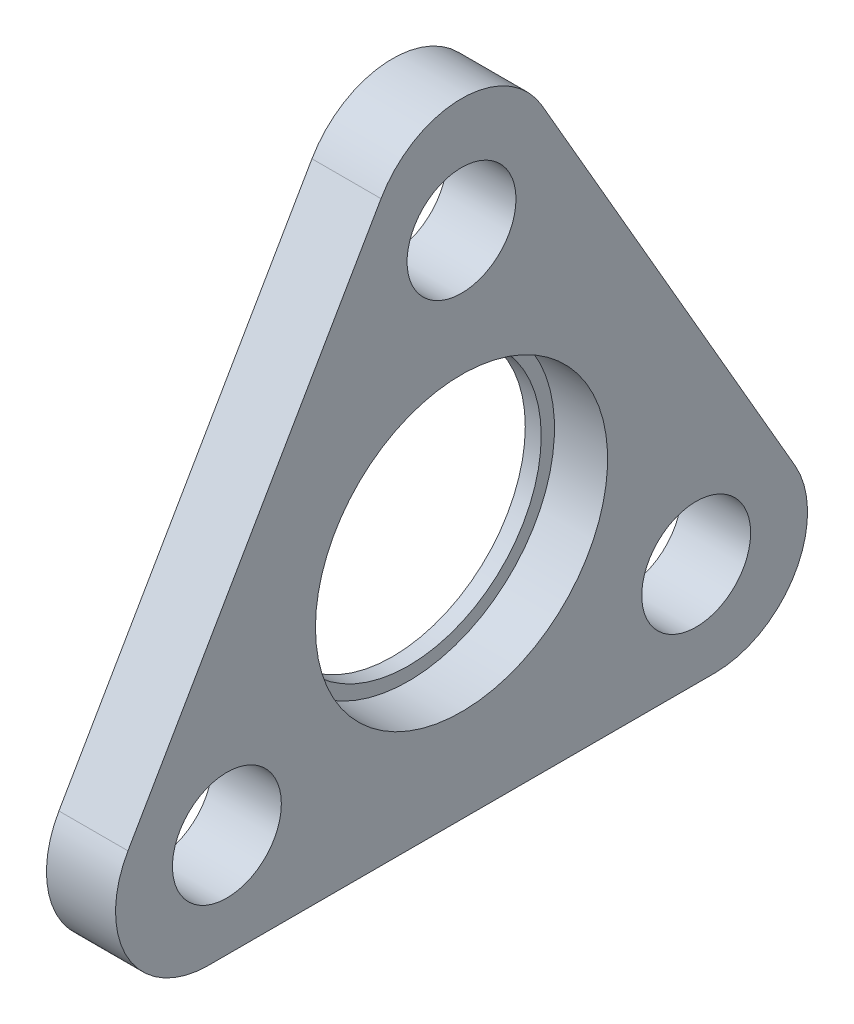
from build123d import *

# Parameters (mm, degrees)
SKETCH_1_R          = 2.05
EXTRUDE_2_DEPTH     = 2.6
FILLET_1_R          = 3.5
SKETCH_4_R          = 5.5
CUT_EXTRUDE_1_DEPTH = 20.664535491
SKETCH_6_R          = 5.5
SKETCH_6_R_2        = 5
EXTRUDE_4_DEPTH     = 0.6


with BuildPart() as part:
    # 草图1 → 凸台-拉伸2 (new body)
    with BuildSketch(Plane(origin=(0, 0, 0), x_dir=(0, 0, -1), z_dir=(1, 0, 0))):
        Polygon((0, 18), (-15.588457268, -9), (15.588457268, -9), align=None)
        with Locations((0, 10.2)):
            Circle(SKETCH_1_R, mode=Mode.SUBTRACT)
        with Locations((8.833459119, -5.1)):
            Circle(SKETCH_1_R, mode=Mode.SUBTRACT)
        with Locations((-8.833459119, -5.1)):
            Circle(SKETCH_1_R, mode=Mode.SUBTRACT)
    extrude(amount=EXTRUDE_2_DEPTH)

    # 圆角1
    fillet_1_edges = [part.edges().sort_by_distance(p)[0] for p in [
        (1.3, 18, 0),
        (1.3, -9, -15.588457268),
        (1.3, -9, 15.588457268),
    ]]
    fillet(fillet_1_edges, radius=FILLET_1_R)

    # 草图4 → 切除-拉伸1 (cut, through all)
    with BuildSketch(Plane.ZY):
        Circle(SKETCH_4_R)
    extrude(amount=-CUT_EXTRUDE_1_DEPTH, mode=Mode.SUBTRACT)


with BuildPart() as body_2:
    # 草图6 → 凸台-拉伸4 (new body)
    with BuildSketch(Plane.ZY):
        Circle(SKETCH_6_R)
        Circle(SKETCH_6_R_2, mode=Mode.SUBTRACT)
    extrude(amount=-EXTRUDE_4_DEPTH)


solid = Compound([part.part, body_2.part])
